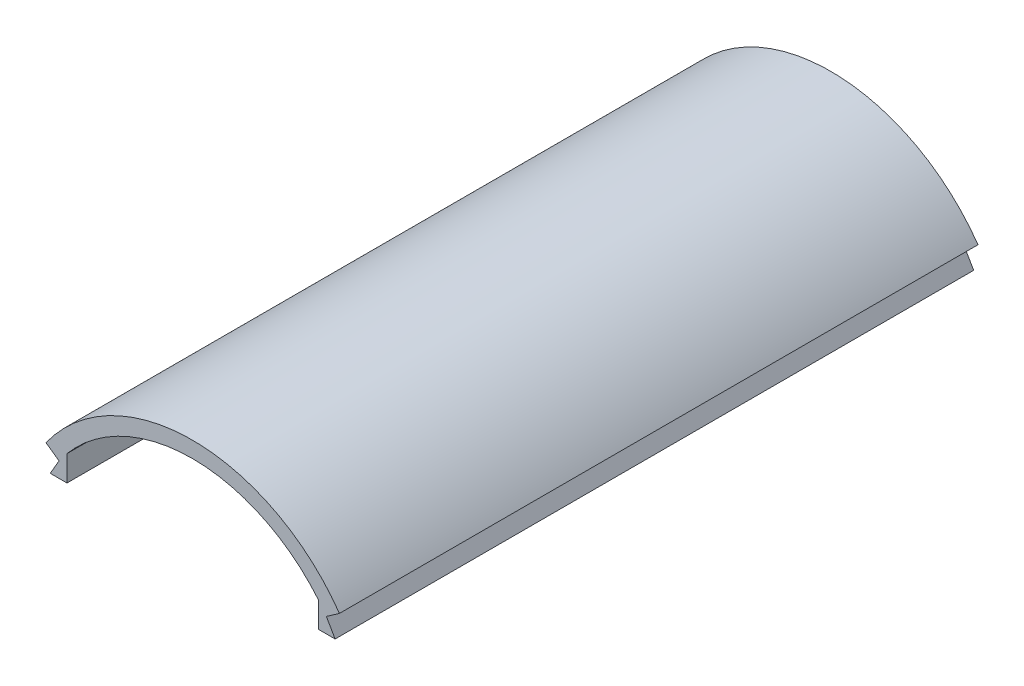
from build123d import *
from build123d.topology import SkipClean

# Parameters (mm, degrees)
SKETCH1_R           = 22.5
SKETCH1_R_2         = 20.5
BOSS_EXTRUDE1_DEPTH = 80
SKETCH2_W           = 45
SKETCH2_H           = 22.5
CUT_EXTRUDE1_DEPTH  = 87.095876789
SKETCH4_W           = 4.401808348
SKETCH4_H           = 1
SKETCH4_W_2         = 1
SKETCH4_H_2         = 3
BOSS_EXTRUDE2_DEPTH = 80
BOSS_EXTRUDE3_START = -80
BOSS_EXTRUDE3_DEPTH = 80
CUT_EXTRUDE2_DEPTH  = 87.095876789


with BuildPart() as part:
    # Sketch1 → Boss-Extrude1 (new body)
    with BuildSketch(Plane.XY):
        Circle(SKETCH1_R)
        Circle(SKETCH1_R_2, mode=Mode.SUBTRACT)
    extrude(amount=BOSS_EXTRUDE1_DEPTH)

    # Sketch2 → Cut-Extrude1 (cut, through all)
    with BuildSketch(Plane.XY.offset(80)):
        with Locations((0, 11.25)):
            Rectangle(SKETCH2_W, SKETCH2_H)
    extrude(amount=-CUT_EXTRUDE1_DEPTH, mode=Mode.SUBTRACT)


with BuildPart() as body_2:
    # Sketch4 → Boss-Extrude2 (new body)
    with BuildSketch(Plane.XY.offset(80)):
        with BuildLine():
            ThreePointArc((22.5, 0), (21.654908627, 6.108594957), (19.183117125, 11.758316945))
            Line((19.183117125, 11.758316945), (19.183117125, 8.758316945))
            Line((19.183117125, 8.758316945), (18.534882905, 8.758316945))
            ThreePointArc((18.534882905, 8.758316945), (20.002688564, 4.488034116), (20.5, 0))
            Line((20.5, 0), (22.5, 0))
        make_face()
        Polygon((16.792616908, 11.758316945), (18.430920997, 12.905469818), (19.183117125, 11.758316945), align=None)
        with BuildLine():
            Line((19.183117125, 8.758316945), (19.183117125, 11.758316945))
            Line((19.183117125, 11.758316945), (16.792616908, 11.758316945))
            ThreePointArc((16.792616908, 11.758316945), (17.439231391, 10.776047906), (18.028456684, 9.758316945))
            ThreePointArc((18.028456684, 9.758316945), (18.288505966, 9.261778962), (18.534882905, 8.758316945))
            Line((18.534882905, 8.758316945), (19.183117125, 8.758316945))
        make_face()
        with BuildLine():
            Line((15.792616908, 9.758316945), (15.792616908, 11.758316945))
            Line((15.792616908, 11.758316945), (14.792616908, 11.758316945))
            Line((14.792616908, 11.758316945), (14.792616908, 8.758316945))
            Line((14.792616908, 8.758316945), (18.534882905, 8.758316945))
            ThreePointArc((18.534882905, 8.758316945), (18.288505966, 9.261778962), (18.028456684, 9.758316945))
            Line((18.028456684, 9.758316945), (15.792616908, 9.758316945))
        make_face()
        with BuildLine():
            Line((-16.702272837, 11.886298081), (-18.340620511, 13.033481472))
            ThreePointArc((-18.340620511, 13.033481472), (-21.43494765, 6.840542322), (-22.5, 0))
            Line((-22.5, 0), (-20.5, 0))
            ThreePointArc((-20.5, 0), (-19.527501033, 6.239126815), (-16.702272837, 11.886298081))
        make_face()
        with Locations((-16.903177011, 9.386298081)):
            Rectangle(SKETCH4_W, SKETCH4_H)
        with Locations((-15.202272837, 10.386298081)):
            Rectangle(SKETCH4_W_2, SKETCH4_H_2)
    extrude(amount=-BOSS_EXTRUDE2_DEPTH)

    # Sketch5 → Boss-Extrude3 (add)
    with SkipClean():  # the faces are left unmerged after this step: merging them gives an invalid solid
        with BuildSketch(Plane.XY.offset(80).offset(BOSS_EXTRUDE3_START)):
            with BuildLine():
                Line((16.792616908, 14.391966981), (16.792616908, 11.758316945))
                Line((16.792616908, 11.758316945), (18.430920997, 12.905469818))
                ThreePointArc((18.430920997, 12.905469818), (0.078328094, 22.49986366), (-18.340620511, 13.033481472))
                Line((-18.340620511, 13.033481472), (-16.702272837, 11.886298081))
                Line((-16.702272837, 11.886298081), (-16.702272837, 13.843152405))
                Line((-16.702272837, 13.843152405), (-15.702272837, 13.843152405))
                Line((-15.702272837, 13.843152405), (-15.702272837, 13.179098139))
                ThreePointArc((-15.702272837, 13.179098139), (0.070554536, 20.499878586), (15.792616908, 13.070702016))
                Line((15.792616908, 13.070702016), (15.792616908, 14.391966981))
                Line((15.792616908, 14.391966981), (16.792616908, 14.391966981))
            make_face()
            with BuildLine():
                Line((15.792616908, 11.758316945), (16.792616908, 11.758316945))
                ThreePointArc((16.792616908, 11.758316945), (16.30582578, 12.424574264), (15.792616908, 13.070702016))
                Line((15.792616908, 13.070702016), (15.792616908, 11.758316945))
            make_face()
            with BuildLine():
                ThreePointArc((15.792616908, 13.070702016), (16.30582578, 12.424574264), (16.792616908, 11.758316945))
                Line((16.792616908, 11.758316945), (16.792616908, 14.391966981))
                Line((16.792616908, 14.391966981), (15.792616908, 14.391966981))
                Line((15.792616908, 14.391966981), (15.792616908, 13.070702016))
            make_face()
            Polygon((17.889582419, 9.858316945), (16.792616908, 11.758316945), (15.792616908, 11.758316945), (15.792616908, 9.858316945), align=None)
            Polygon((-15.702272837, 11.886298081), (-15.702272837, 9.986298081), (-17.799238349, 9.986298081), (-16.702272837, 11.886298081), align=None)
            with BuildLine():
                Line((-15.702272837, 11.886298081), (-15.702272837, 13.179098139))
                ThreePointArc((-15.702272837, 13.179098139), (-16.215161982, 12.542668054), (-16.702272837, 11.886298081))
                Line((-16.702272837, 11.886298081), (-15.702272837, 11.886298081))
            make_face()
            with BuildLine():
                ThreePointArc((-16.702272837, 11.886298081), (-16.215161982, 12.542668054), (-15.702272837, 13.179098139))
                Line((-15.702272837, 13.179098139), (-15.702272837, 13.843152405))
                Line((-15.702272837, 13.843152405), (-16.702272837, 13.843152405))
                Line((-16.702272837, 13.843152405), (-16.702272837, 11.886298081))
            make_face()
        extrude(amount=BOSS_EXTRUDE3_DEPTH)


with BuildPart() as cut_extrude2_tool:
    # Sketch6 → Cut-Extrude2 (new, through all)
    with BuildSketch(Plane.XY.offset(80)):
        with BuildLine():
            Line((-22.5, 0), (-20.5, 0))
            ThreePointArc((-20.5, 0), (-19.98704884, 4.557178804), (-18.473865497, 8.886298081))
            Line((-18.473865497, 8.886298081), (-19.42662195, 8.886298081))
            Line((-19.42662195, 8.886298081), (-19.42662195, 9.886298081))
            Line((-19.42662195, 9.886298081), (-17.958594328, 9.886298081))
            ThreePointArc((-17.958594328, 9.886298081), (-17.359260588, 10.904406074), (-16.702272837, 11.886298081))
            Line((-16.702272837, 11.886298081), (-18.33176287, 13.045936918))
            ThreePointArc((-18.33176287, 13.045936918), (-21.432623085, 6.847822114), (-22.5, 0))
        make_face()
        with BuildLine():
            Line((22.5, 0), (20.5, 0))
            ThreePointArc((20.5, 0), (0, -20.5), (-20.5, 0))
            Line((-20.5, 0), (-22.5, 0))
            ThreePointArc((-22.5, 0), (0, -22.5), (22.5, 0))
        make_face()
        with BuildLine():
            Line((-19.42662195, 8.886298081), (-18.473865497, 8.886298081))
            ThreePointArc((-18.473865497, 8.886298081), (-18.223090634, 9.389833213), (-17.958594328, 9.886298081))
            Line((-17.958594328, 9.886298081), (-19.42662195, 9.886298081))
            Line((-19.42662195, 9.886298081), (-19.42662195, 8.886298081))
        make_face()
        with BuildLine():
            ThreePointArc((-17.958594328, 9.886298081), (-18.223090634, 9.389833213), (-18.473865497, 8.886298081))
            Line((-18.473865497, 8.886298081), (-15.702272837, 8.886298081))
            Line((-15.702272837, 8.886298081), (-15.702272837, 9.886298081))
            Line((-15.702272837, 9.886298081), (-17.958594328, 9.886298081))
        make_face()
        Polygon((-15.702272837, 9.886298081), (-15.702272837, 8.886298081), (-14.702272837, 8.886298081), (-14.702272837, 11.886298081), (-15.702272837, 11.886298081), (-15.702272837, 9.986298081), align=None)
        Polygon((15.792616908, 11.758316945), (14.792616908, 11.758316945), (14.792616908, 8.758316945), (15.792616908, 8.758316945), (15.792616908, 9.758316945), (15.792616908, 9.858316945), align=None)
        with BuildLine():
            Line((15.792616908, 9.758316945), (15.792616908, 8.758316945))
            Line((15.792616908, 8.758316945), (18.534882905, 8.758316945))
            ThreePointArc((18.534882905, 8.758316945), (18.288505966, 9.261778962), (18.028456684, 9.758316945))
            Line((18.028456684, 9.758316945), (15.792616908, 9.758316945))
        make_face()
        with BuildLine():
            ThreePointArc((18.028456684, 9.758316945), (18.288505966, 9.261778962), (18.534882905, 8.758316945))
            Line((18.534882905, 8.758316945), (19.161355292, 8.758316945))
            Line((19.161355292, 8.758316945), (19.161355292, 9.758316945))
            Line((19.161355292, 9.758316945), (18.028456684, 9.758316945))
        make_face()
        with BuildLine():
            Line((19.161355292, 8.758316945), (18.534882905, 8.758316945))
            ThreePointArc((18.534882905, 8.758316945), (20.002688564, 4.488034116), (20.5, 0))
            Line((20.5, 0), (22.5, 0))
            ThreePointArc((22.5, 0), (21.654908627, 6.108594957), (19.183117125, 11.758316945))
            Line((19.183117125, 11.758316945), (18.430920997, 12.905469818))
            Line((18.430920997, 12.905469818), (16.792616908, 11.758316945))
            ThreePointArc((16.792616908, 11.758316945), (17.439231391, 10.776047906), (18.028456684, 9.758316945))
            Line((18.028456684, 9.758316945), (19.161355292, 9.758316945))
            Line((19.161355292, 9.758316945), (19.161355292, 8.758316945))
        make_face()
    extrude(amount=-CUT_EXTRUDE2_DEPTH)


with BuildPart() as part_1:
    add(part.part)

    # Cut-Extrude2: cut by cut_extrude2_tool
    add(cut_extrude2_tool.part, mode=Mode.SUBTRACT)


with BuildPart() as body_2_1:
    add(body_2.part)

    # Cut-Extrude2: cut by cut_extrude2_tool
    add(cut_extrude2_tool.part, mode=Mode.SUBTRACT)


solid = body_2_1.part
